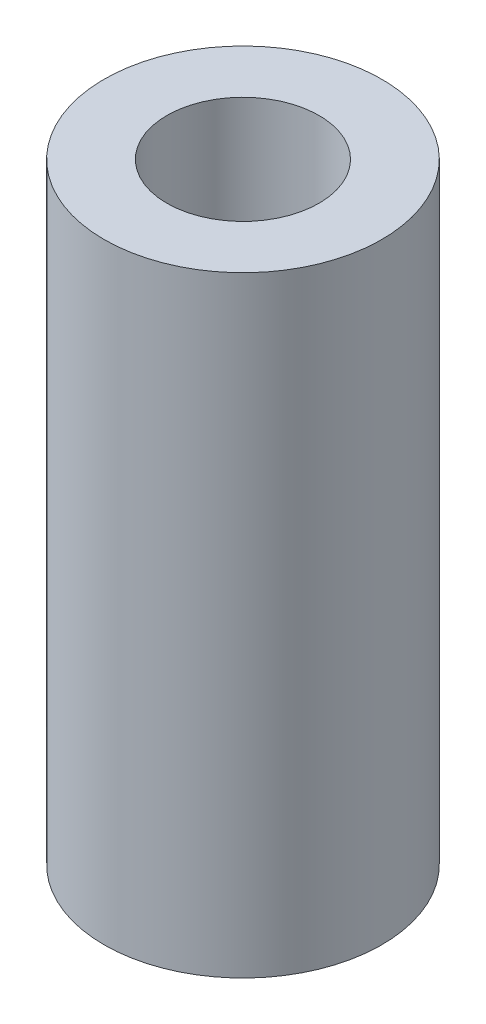
from build123d import *

# Parameters (mm, degrees)
SKETCH1_R           = 6.35
SKETCH1_R_2         = 3.4798
BOSS_EXTRUDE1_DEPTH = 27.937258043


with BuildPart() as part:
    # Sketch1 → Boss-Extrude1 (new body)
    with BuildSketch(Plane(origin=(0, 0, 0), x_dir=(1, 0, 0), z_dir=(0, 1, 0))):
        with Locations(Location((0, 0, 0), (0, 0, 270))):
            Circle(SKETCH1_R)
        with Locations(Location((1.206e-06, -3.7e-08, 0), (0, 0, 270))):
            Circle(SKETCH1_R_2, mode=Mode.SUBTRACT)
    extrude(amount=BOSS_EXTRUDE1_DEPTH)


solid = part.part
